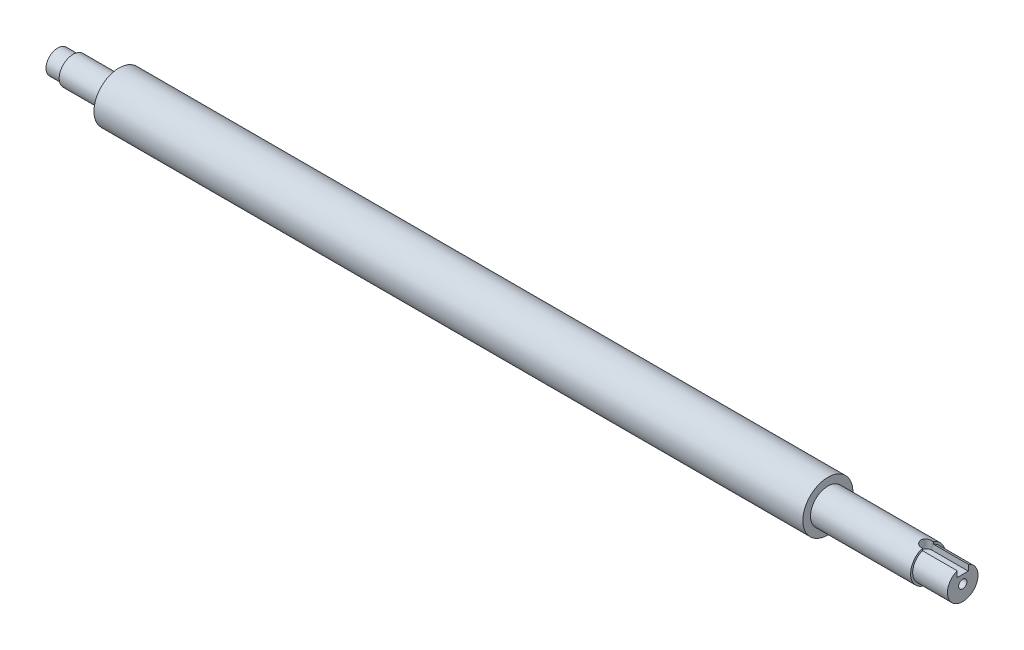
from build123d import *

# Parameters (mm, degrees)
CUT_EXTRUDE1_DEPTH = 14
SKETCH4_R          = 3
CUT_EXTRUDE2_DEPTH = 25


with BuildPart() as part:
    # Sketch1 → Revolve1 (revolve)
    with BuildSketch(Plane.XY):
        Polygon((254.240699987, 11), (279.240699987, 11), (279.240699987, 0), (-371.759300013, 0), (-371.759300013, 8.5), (-360.759300013, 8.5), (-360.759300013, 10), (-327.759300013, 10), (-327.759300013, 18), (182.240699987, 18), (182.240699987, 12.5), (254.240699987, 12.5), align=None)
    revolve(axis=Axis((279.240699987, 0, 0), (-1, 0, 0)))

    # Sketch3 → Cut-Extrude1 (cut)
    with BuildSketch(Plane(origin=(0, 20, 0), x_dir=(1, 0, 0), z_dir=(0, 1, 0))):
        with BuildLine():
            Line((279.240699987, -4), (253.217727507, -4))
            ThreePointArc((253.217727507, -4), (249.217727507, 0), (253.217727507, 4))
            Line((253.217727507, 4), (279.240699987, 4))
            ThreePointArc((279.240699987, 4), (283.240699987, 0), (279.240699987, -4))
        make_face()
    extrude(amount=-CUT_EXTRUDE1_DEPTH, mode=Mode.SUBTRACT)

    # Sketch4 → Cut-Extrude2 (cut)
    with BuildSketch(Plane(origin=(279.240699987, 0, 0), x_dir=(0, 0, -1), z_dir=(1, 0, 0))):
        with Locations(Location((0, 0, 0), (0, 0, 90))):
            Circle(SKETCH4_R)
    extrude(amount=-CUT_EXTRUDE2_DEPTH, mode=Mode.SUBTRACT)


solid = part.part
